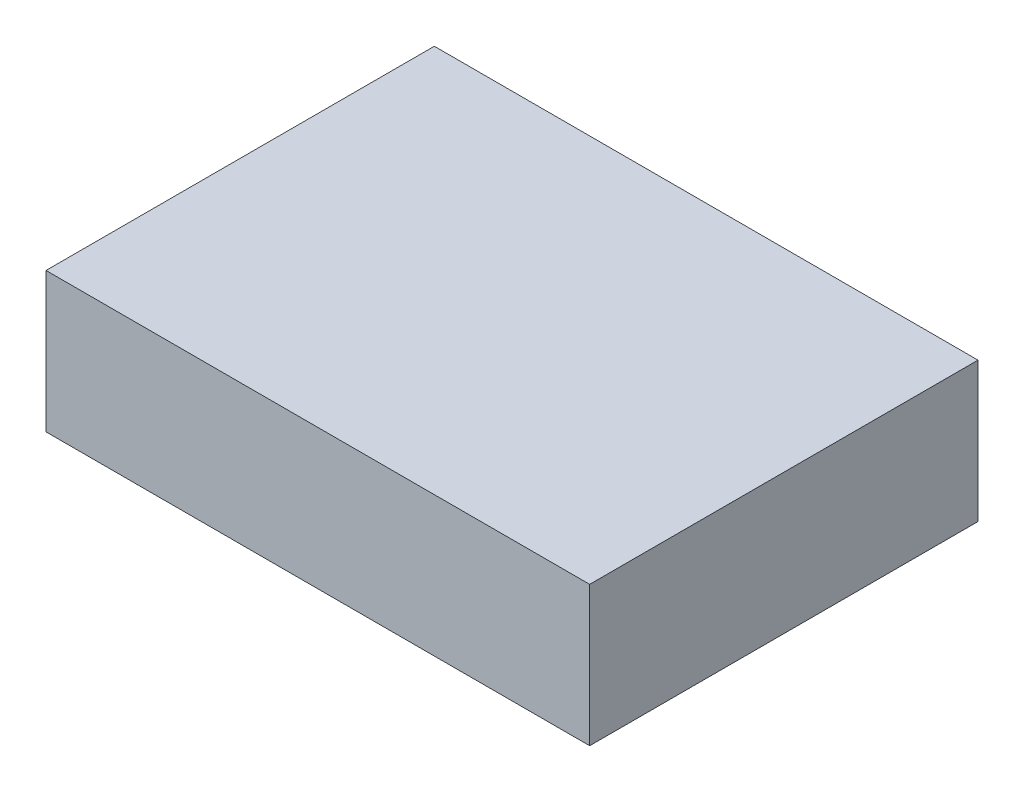
from build123d import *

# Parameters (mm, degrees)
SKETCH_1_W      = 70
SKETCH_1_H      = 50
EXTRUDE_1_DEPTH = 18


with BuildPart() as part:
    # 草图1 → 凸台-拉伸1 (new body)
    with BuildSketch(Plane(origin=(0, 0, 0), x_dir=(1, 0, 0), z_dir=(0, 1, 0))):
        Rectangle(SKETCH_1_W, SKETCH_1_H)
    extrude(amount=EXTRUDE_1_DEPTH)


solid = part.part
